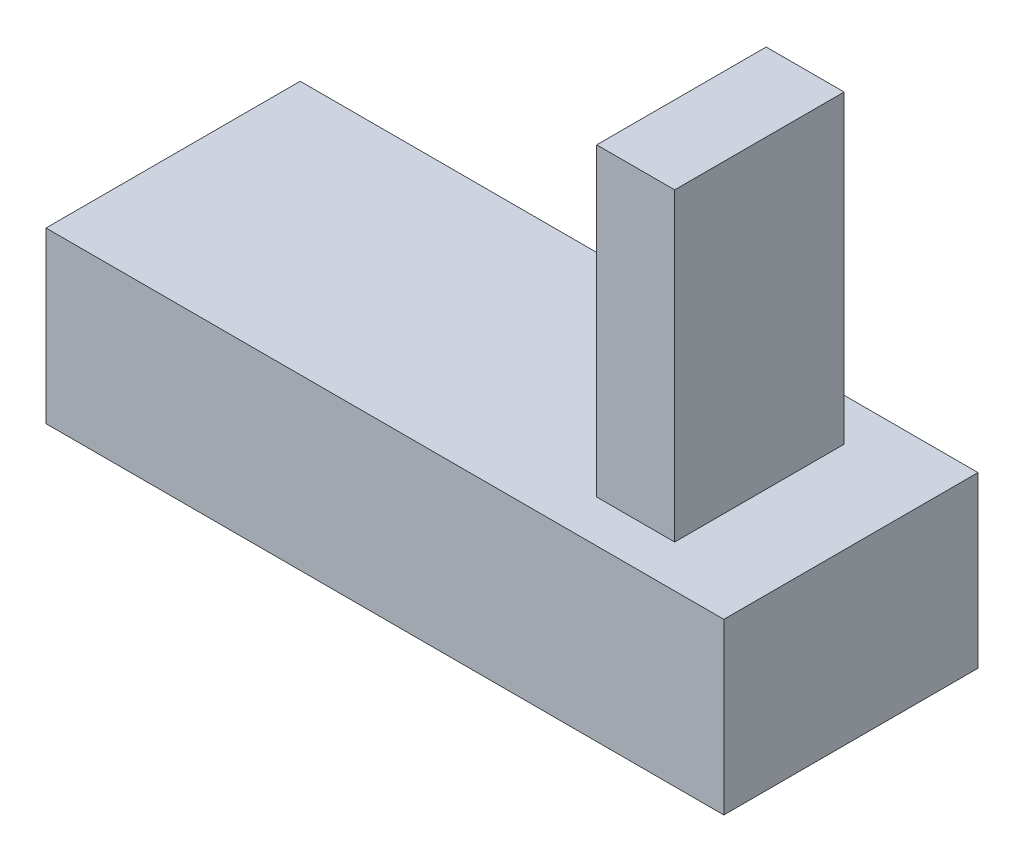
from build123d import *

# Parameters (mm, degrees)
SKETCH1_W           = 40
SKETCH1_H           = 15
BOSS_EXTRUDE1_DEPTH = 10
SKETCH2_W           = 4.6
SKETCH2_H           = 10
BOSS_EXTRUDE2_DEPTH = 18


with BuildPart() as part:
    # Sketch1 → Boss-Extrude1 (new body)
    with BuildSketch(Plane(origin=(0, 0, 0), x_dir=(1, 0, 0), z_dir=(0, 1, 0))):
        Rectangle(SKETCH1_W, SKETCH1_H)
    extrude(amount=BOSS_EXTRUDE1_DEPTH)

    # Sketch2 → Boss-Extrude2 (add)
    with BuildSketch(Plane(origin=(0, 10, 0), x_dir=(1, 0, 0), z_dir=(0, 1, 0))):
        with Locations((12.3, 0)):
            Rectangle(SKETCH2_W, SKETCH2_H)
    extrude(amount=BOSS_EXTRUDE2_DEPTH)


solid = part.part
